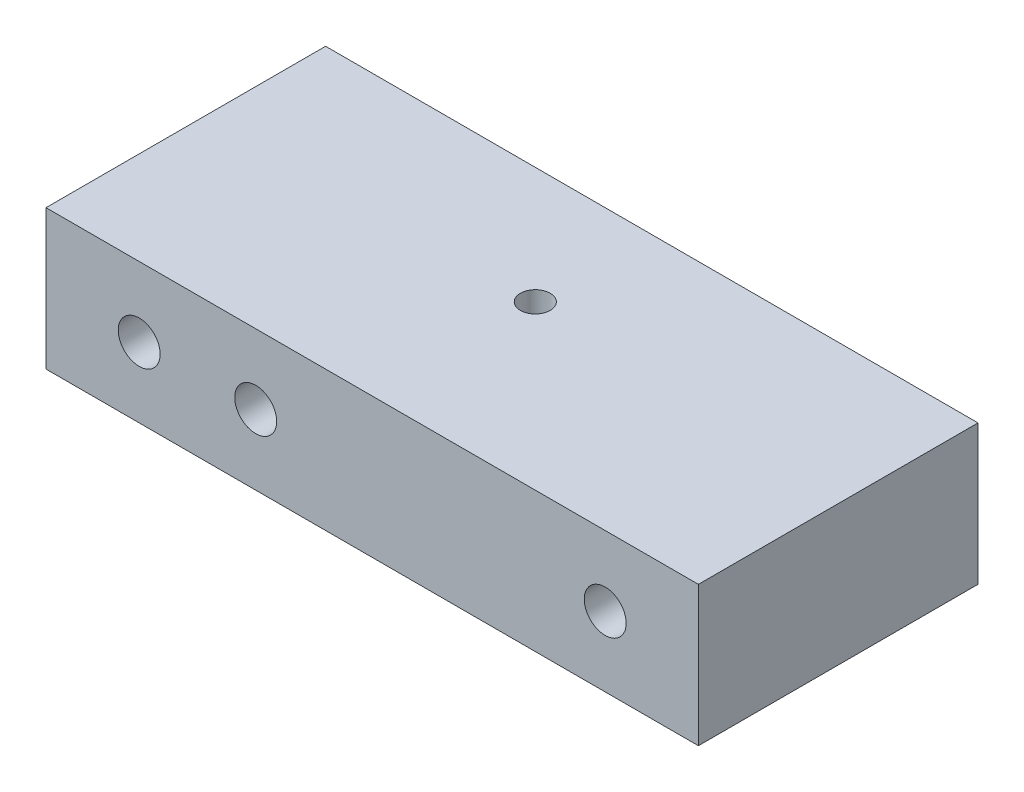
from build123d import *

# Parameters (mm, degrees)
SKETCH1_W           = 140
SKETCH1_H           = 60
BOSS_EXTRUDE1_DEPTH = 30
SKETCH2_R           = 4.5
CUT_EXTRUDE1_DEPTH  = 60
SKETCH3_R           = 3.2
CUT_EXTRUDE2_DEPTH  = 30


with BuildPart() as part:
    # Sketch1 → Boss-Extrude1 (new body)
    with BuildSketch(Plane(origin=(0, 0, 0), x_dir=(1, 0, 0), z_dir=(0, 1, 0))):
        Rectangle(SKETCH1_W, SKETCH1_H)
    extrude(amount=BOSS_EXTRUDE1_DEPTH)

    # Sketch2 → Cut-Extrude1 (cut)
    with BuildSketch(Plane.XY.offset(30)):
        with Locations((50, 15)):
            Circle(SKETCH2_R)
        with Locations((-50, 15)):
            Circle(SKETCH2_R)
        with Locations((-25, 15)):
            Circle(SKETCH2_R)
    extrude(amount=-CUT_EXTRUDE1_DEPTH, mode=Mode.SUBTRACT)

    # Sketch3 → Cut-Extrude2 (cut)
    with BuildSketch(Plane(origin=(0, 30, 0), x_dir=(1, 0, 0), z_dir=(0, 1, 0))):
        with Locations(Location((0, 5, 0), (0, 0, 270))):
            Circle(SKETCH3_R)
    extrude(amount=-CUT_EXTRUDE2_DEPTH, mode=Mode.SUBTRACT)


solid = part.part
